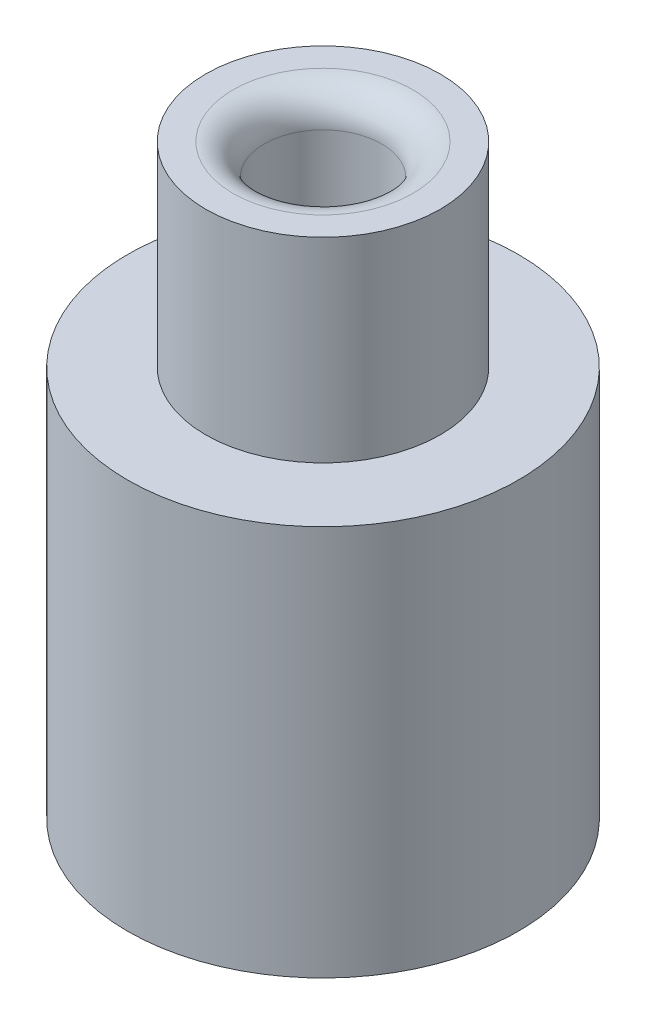
from build123d import *

# Parameters (mm, degrees)
BOSS_EXTRU_1_DEPTH      = 6
BOSS_EXTRU_1_DEPTH_BACK = 4
ESQUISSE1_R             = 5
BOSS_EXTRU_2_DEPTH      = 5
BOSS_EXTRU_2_DEPTH_BACK = 1
ESQUISSE2_R             = 3
ESQUISSE3_R             = 1.5
ENL_V_MAT_EXTRU_2_DEPTH = 10
ESQUISSE4_R             = 2.5
ENL_V_MAT_EXTRU_3_DEPTH = 5
CONG_1_R                = 0.8


with BuildPart() as part:
    # Esquisse1 → Boss.-Extru.1 (new, two sides: drawn at the far end of the back side and taken through both)
    with BuildSketch(Plane(origin=(0, 0, 0), x_dir=(1, 0, 0), z_dir=(0, 1, 0)).offset(-BOSS_EXTRU_1_DEPTH_BACK)):
        with Locations(Location((0, 0, 0), (0, 0, 270))):
            Circle(ESQUISSE1_R)
    extrude(amount=BOSS_EXTRU_1_DEPTH + BOSS_EXTRU_1_DEPTH_BACK)

    # Esquisse2 → Boss.-Extru.2 (add, two sides: drawn at the far end of the back side and taken through both)
    with BuildSketch(Plane(origin=(0, 6, 0), x_dir=(1, 0, 0), z_dir=(0, 1, 0)).offset(-BOSS_EXTRU_2_DEPTH_BACK)):
        with Locations(Location((0, 0, 0), (0, 0, 270))):
            Circle(ESQUISSE2_R)
    extrude(amount=BOSS_EXTRU_2_DEPTH + BOSS_EXTRU_2_DEPTH_BACK)

    # Esquisse3 → Enlèv. mat.-Extru.2 (cut)
    with BuildSketch(Plane(origin=(0, 11, 0), x_dir=(1, 0, 0), z_dir=(0, 1, 0))):
        with Locations(Location((0, 0, 0), (0, 0, 270))):
            Circle(ESQUISSE3_R)
    extrude(amount=-ENL_V_MAT_EXTRU_2_DEPTH, mode=Mode.SUBTRACT)

    # Esquisse4 → Enlèv. mat.-Extru.3 (cut)
    with BuildSketch(Plane.XZ.offset(4)):
        with Locations(Location((0, 0, 0), (0, 0, 270))):
            Circle(ESQUISSE4_R)
    extrude(amount=-ENL_V_MAT_EXTRU_3_DEPTH, mode=Mode.SUBTRACT)

    # Congé1
    cong_1_edges = [part.edges().sort_by_distance(p)[0] for p in [
        (0, 11, -1.5),
    ]]
    fillet(cong_1_edges, radius=CONG_1_R)


solid = part.part
